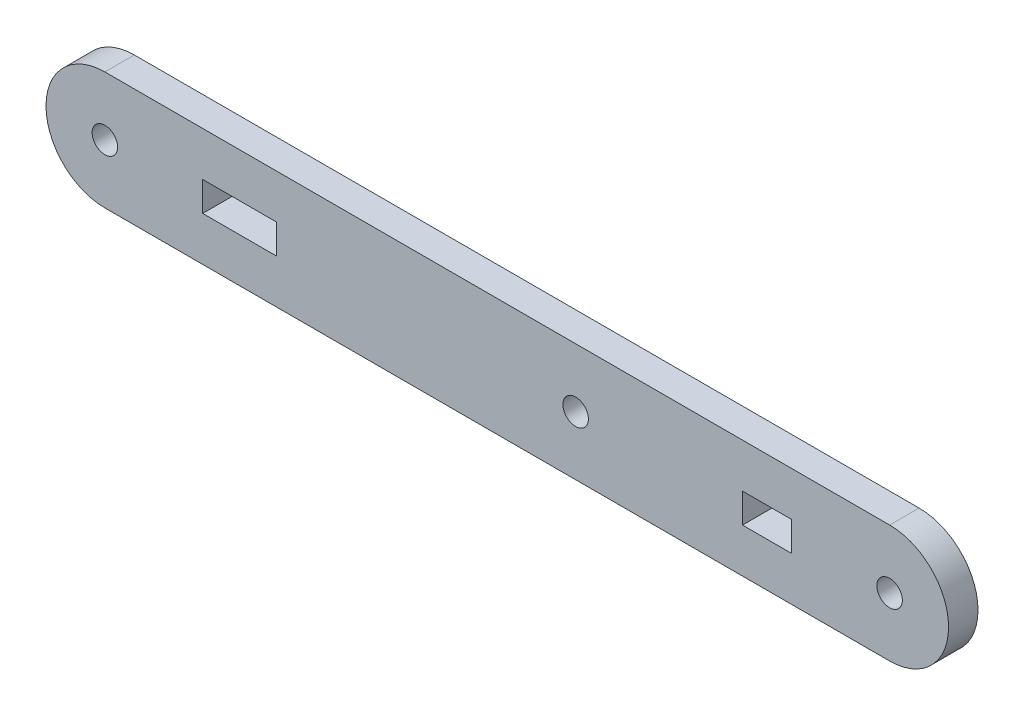
from build123d import *

# Parameters (mm, degrees)
SKETCH_1_R      = 1.3
SKETCH_1_W      = 7.4992
SKETCH_1_H      = 3.0001
SKETCH_1_W_2    = 4.9995
EXTRUDE_1_DEPTH = 3


with BuildPart() as part:
    # 草图1 → 凸台-拉伸1 (new body)
    with BuildSketch(Plane.XY.offset(3)):
        with BuildLine():
            Line((-49.343510787, 0), (30.618171933, 0))
            ThreePointArc((30.618171933, 0), (36.618171933, 6), (30.618171933, 12))
            Line((30.618171933, 12), (-49.343510787, 12))
            ThreePointArc((-49.343510787, 12), (-55.343510787, 6), (-49.343510787, 0))
        make_face()
        with Locations(Location((30.611606698, 6.0001, 0), (0, 0, 180))):
            Circle(SKETCH_1_R, mode=Mode.SUBTRACT)
        with Locations(Location((-1.379286828, 6.00015, 0), (0, 0, 180))):
            Circle(SKETCH_1_R, mode=Mode.SUBTRACT)
        with Locations(Location((-49.343510787, 6, 0), (0, 0, 180))):
            Circle(SKETCH_1_R, mode=Mode.SUBTRACT)
        with Locations((-35.628693302, 5.99945)):
            Rectangle(SKETCH_1_W, SKETCH_1_H, mode=Mode.SUBTRACT)
        with Locations((18.121556698, 5.99945)):
            Rectangle(SKETCH_1_W_2, SKETCH_1_H, mode=Mode.SUBTRACT)
    extrude(amount=-EXTRUDE_1_DEPTH)


solid = part.part
